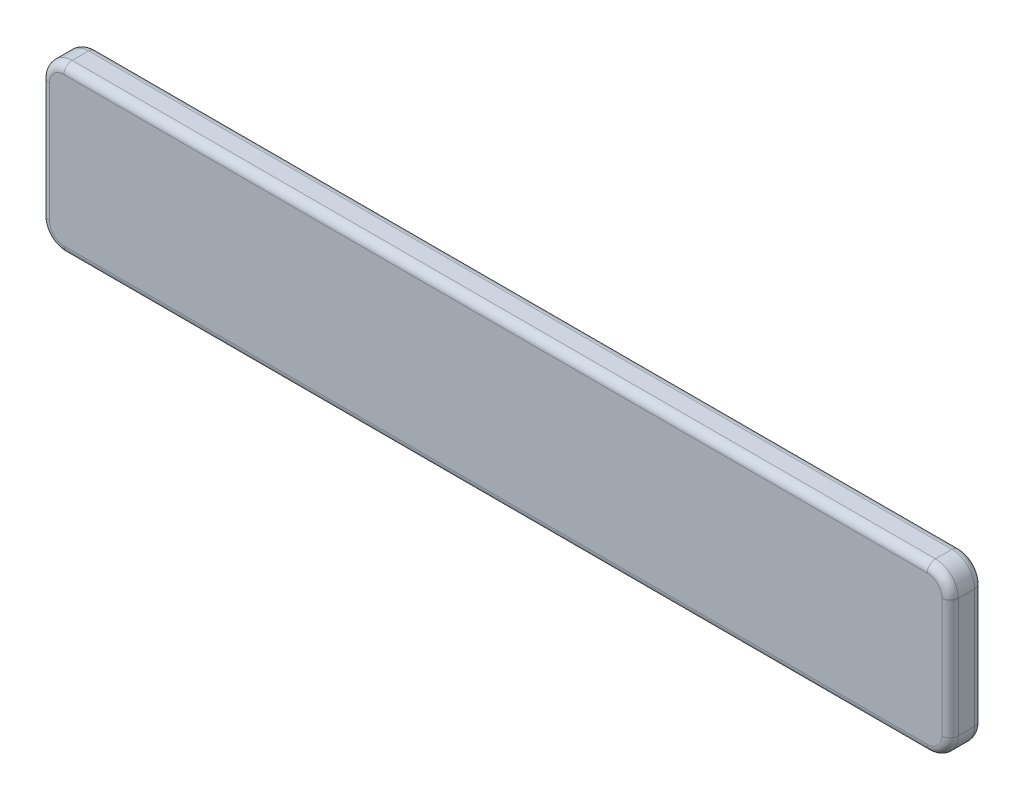
from build123d import *

# Parameters (mm, degrees)
BOSS_EXTRUDE1_DEPTH = 12.7
FILLET1_R           = 3.175
FILLET2_R           = 3.175


with BuildPart() as part:
    # Sketch1 → Boss-Extrude1 (new body)
    with BuildSketch(Plane.XY):
        with BuildLine():
            Line((-157.3022, -57.5818), (157.3022, -57.5818))
            Line((157.3022, -57.5818), (167.513, -57.5818))
            ThreePointArc((167.513, -57.5818), (173.76325826, -54.99285826), (176.3522, -48.7426))
            Line((176.3522, -48.7426), (176.3522, -2.4892))
            ThreePointArc((176.3522, -2.4892), (173.76325826, 3.76105826), (167.513, 6.35))
            Line((167.513, 6.35), (-167.513, 6.35))
            ThreePointArc((-167.513, 6.35), (-173.76325826, 3.76105826), (-176.3522, -2.4892))
            Line((-176.3522, -2.4892), (-176.3522, -48.7426))
            ThreePointArc((-176.3522, -48.7426), (-173.76325826, -54.99285826), (-167.513, -57.5818))
            Line((-167.513, -57.5818), (-157.3022, -57.5818))
        make_face()
    extrude(amount=BOSS_EXTRUDE1_DEPTH)

    # Fillet1
    fillet1_edges = [part.edges().sort_by_distance(p)[0] for p in [
        (173.76325826, -54.99285826, 12.7),
        (176.3522, -25.6159, 12.7),
        (173.76325826, 3.76105826, 12.7),
        (0, 6.35, 12.7),
        (-173.76325826, 3.76105826, 12.7),
        (-176.3522, -25.6159, 12.7),
        (-173.76325826, -54.99285826, 12.7),
        (0, -57.5818, 12.7),
    ]]
    fillet(fillet1_edges, radius=FILLET1_R)

    # Fillet2
    fillet2_edges = [part.edges().sort_by_distance(p)[0] for p in [
        (-176.3522, -25.6159, 0),
        (-173.76325826, 3.76105826, 0),
        (0, 6.35, 0),
        (173.76325826, 3.76105826, 0),
        (176.3522, -25.6159, 0),
        (173.76325826, -54.99285826, 0),
        (0, -57.5818, 0),
        (-173.76325826, -54.99285826, 0),
    ]]
    fillet(fillet2_edges, radius=FILLET2_R)


solid = part.part
